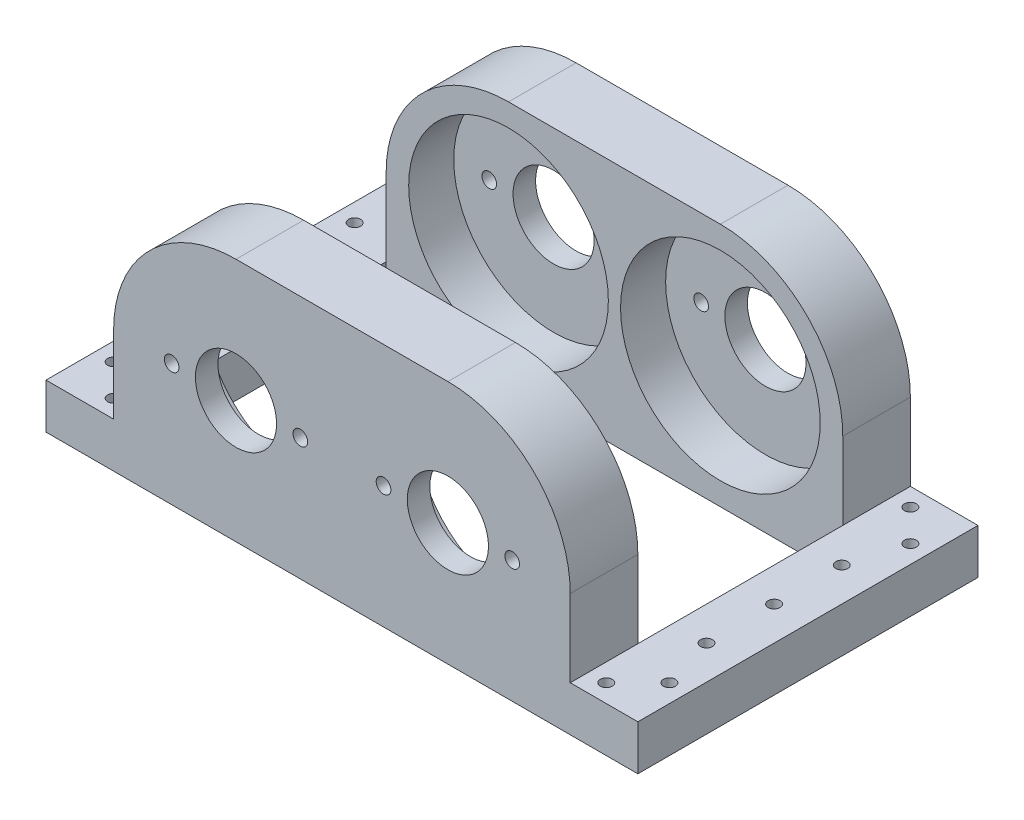
from build123d import *

# Parameters (mm, degrees)
SKETCH2_R                 = 22.50059
BOSS_EXTRUDE1_DEPTH       = 7.62
SKETCH6_R                 = 22.50059
SKETCH6_R_2               = 9.144
BOSS_EXTRUDE2_DEPTH       = 5.08
SKETCH7_R                 = 1.651
CUT_EXTRUDE1_DEPTH        = 7.62
SKETCH8_R                 = 1.651
CUT_EXTRUDE2_DEPTH        = 107.53344751
TAP_DRILL_FOR_6_32_TAP1_D = 2.7051
SKETCH11_W                = 15.24
SKETCH11_H                = 10.16
BOSS_EXTRUDE3_DEPTH       = 23.08987
TAP_DRILL_FOR_6_32_TAP2_D = 2.7051


with BuildPart() as part:
    # Sketch2 → Boss-Extrude1 (new, symmetric)
    with BuildSketch(Plane.XY):
        with BuildLine():
            Line((-47.752, 55.16118), (0, 55.16118))
            ThreePointArc((0, 55.16118), (19.502422218, 47.083012218), (27.58059, 27.58059))
            Line((27.58059, 27.58059), (27.58059, 10.16))
            Line((27.58059, 10.16), (42.82059, 10.16))
            Line((42.82059, 10.16), (42.82059, 0))
            Line((42.82059, 0), (-42.82059, 0))
            Line((-42.82059, 0), (-90.57259, 0))
            Line((-90.57259, 0), (-90.57259, 10.16))
            Line((-90.57259, 10.16), (-75.33259, 10.16))
            Line((-75.33259, 10.16), (-75.33259, 27.58059))
            ThreePointArc((-75.33259, 27.58059), (-67.254422218, 47.083012218), (-47.752, 55.16118))
        make_face()
        with Locations((0, 27.58059)):
            Circle(SKETCH2_R, mode=Mode.SUBTRACT)
        with Locations((-47.752, 27.58059)):
            Circle(SKETCH2_R, mode=Mode.SUBTRACT)
    extrude(amount=BOSS_EXTRUDE1_DEPTH, both=True)

    # Sketch6 → Boss-Extrude2 (add)
    # profile 1 of 2: a face of its own
    with BuildSketch(Plane(origin=(0, 0, -7.62), x_dir=(-1, 0, 0), z_dir=(0, 0, -1))):
        with Locations((0, 27.58059)):
            Circle(SKETCH6_R)
        with Locations((0, 27.58059)):
            Circle(SKETCH6_R_2, mode=Mode.SUBTRACT)
    # profile 2 of 2: a face of its own
    with BuildSketch(Plane(origin=(0, 0, -7.62), x_dir=(-1, 0, 0), z_dir=(0, 0, -1))):
        with Locations((47.752, 27.58059)):
            Circle(SKETCH6_R)
        with Locations((47.752, 27.58059)):
            Circle(SKETCH6_R_2, mode=Mode.SUBTRACT)
    extrude(amount=-BOSS_EXTRUDE2_DEPTH)

    # Sketch7 → Cut-Extrude1 (cut)
    with BuildSketch(Plane(origin=(0, 0, -7.62), x_dir=(-1, 0, 0), z_dir=(0, 0, -1))):
        with Locations((-14.49959, 27.58059)):
            Circle(SKETCH7_R)
        with Locations((14.49959, 27.58059)):
            Circle(SKETCH7_R)
    extrude(amount=-CUT_EXTRUDE1_DEPTH, mode=Mode.SUBTRACT)

    # Sketch8 → Cut-Extrude2 (cut, through all)
    with BuildSketch(Plane.XY.offset(-2.54)):
        with Locations((-33.25241, 27.58059)):
            Circle(SKETCH8_R)
        with Locations((-62.25159, 27.58059)):
            Circle(SKETCH8_R)
    extrude(amount=-CUT_EXTRUDE2_DEPTH, mode=Mode.SUBTRACT)

    # Tap Drill for #6-32 Tap1 (through all)
    with Locations(Plane(origin=(0, 10.16, 0), x_dir=(1, 0, 0), z_dir=(0, 1, 0))):
        with Locations((-79.39659, 3.556), (-86.50859, -3.556)):
            tap_drill_for_6_32_tap1 = Hole(TAP_DRILL_FOR_6_32_TAP1_D / 2)

    # Mirror1: Tap Drill for #6-32 Tap1 across plane
    add(tap_drill_for_6_32_tap1.mirror(Plane.ZY.offset(23.876)), mode=Mode.SUBTRACT)

    # Sketch11 → Boss-Extrude3 (add)
    with BuildSketch(Plane.XY.offset(7.62)):
        with Locations((-82.95259, 5.08)):
            Rectangle(SKETCH11_W, SKETCH11_H)
        with Locations((35.20059, 5.08)):
            Rectangle(SKETCH11_W, SKETCH11_H)
    extrude(amount=BOSS_EXTRUDE3_DEPTH)

    # Mirror5: part across plane


with BuildPart() as part_1:
    add(part.part)
    add(part.part.mirror(Plane.XY.offset(30.70987)))

    # Tap Drill for #6-32 Tap2 (through all)
    with Locations(Plane(origin=(0, 10.16, 0), x_dir=(1, 0, 0), z_dir=(0, 1, 0))):
        with Locations((-82.95259, -30.70987), (-82.95259, -45.94987), (-82.95259, -15.46987)):
            tap_drill_for_6_32_tap2 = Hole(TAP_DRILL_FOR_6_32_TAP2_D / 2)

    # Mirror6: Tap Drill for #6-32 Tap2 across plane
    add(tap_drill_for_6_32_tap2.mirror(Plane.ZY.offset(23.876)), mode=Mode.SUBTRACT)


solid = part_1.part
